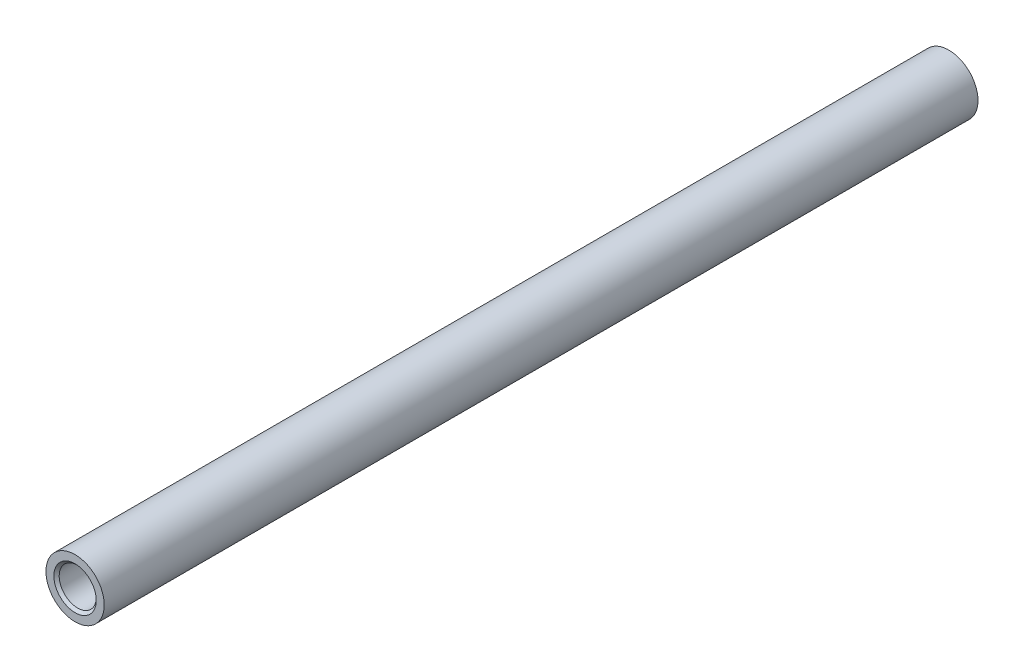
from build123d import *

# Parameters (mm, degrees)
SZKIC1_R                    = 11
SZKIC1_R_2                  = 7
DODANIE_WYCI_GNI_CIE1_DEPTH = 165
SZKIC2_R                    = 8
WYTNIJ_WYCI_GNI_CIE1_DEPTH  = 50
SFAZOWANIE1_SIZE            = 1


with BuildPart() as part:
    # Szkic1 → Dodanie-wyciągnięcie1 (new, symmetric)
    with BuildSketch(Plane.XY):
        Circle(SZKIC1_R)
        Circle(SZKIC1_R_2, mode=Mode.SUBTRACT)
    extrude(amount=DODANIE_WYCI_GNI_CIE1_DEPTH, both=True)

    # Szkic2 → Wytnij-wyciągnięcie1 (cut)
    with BuildSketch(Plane(origin=(0, 0, -165), x_dir=(-1, 0, 0), z_dir=(0, 0, -1))):
        Circle(SZKIC2_R)
    extrude(amount=-WYTNIJ_WYCI_GNI_CIE1_DEPTH, mode=Mode.SUBTRACT)

    # Sfazowanie1
    sfazowanie1_edges = [part.edges().sort_by_distance(p)[0] for p in [
        (-7, 0, 165),
    ]]
    chamfer(sfazowanie1_edges, length=SFAZOWANIE1_SIZE)


solid = part.part
